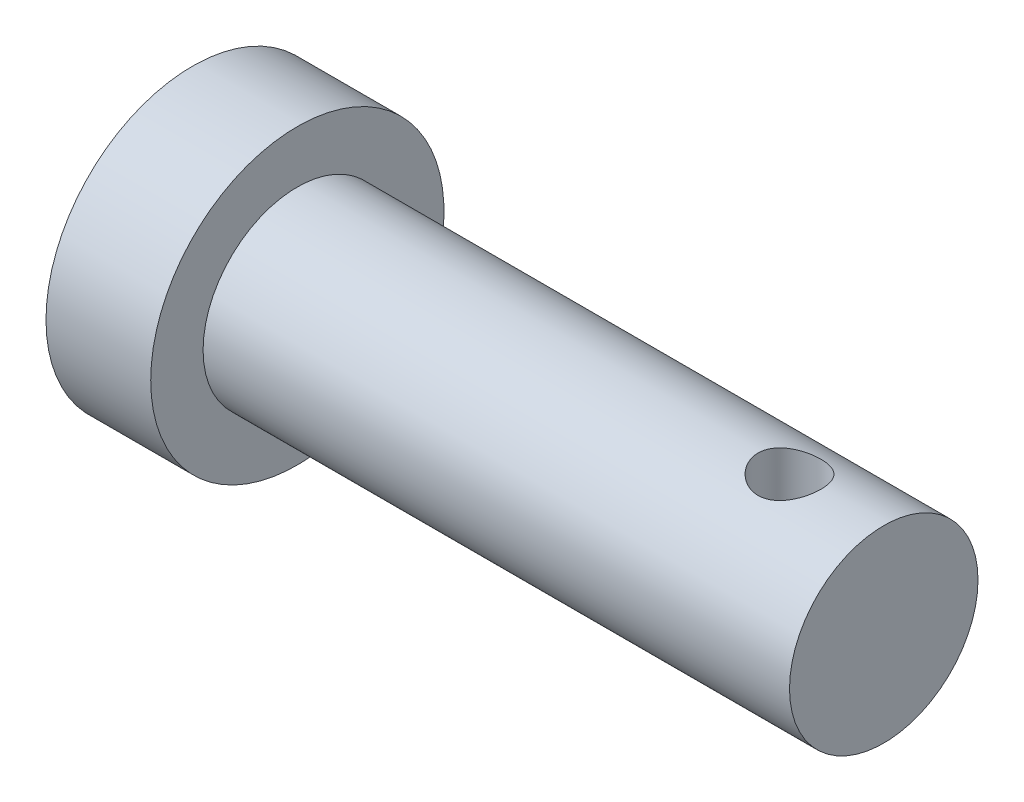
from build123d import *

# Parameters (mm, degrees)
SKETCH1_R               = 4.5
BOSS_EXTRUDE1_DEPTH     = 33
SKETCH2_R               = 7
BOSS_EXTRUDE2_DEPTH     = 5
CUT_EXTRUDE1_DEPTH      = 35.452866354
CUT_EXTRUDE1_DEPTH_BACK = 35.452866354
SKETCH3_R               = 1.5


with BuildPart() as part:
    # Sketch1 → Boss-Extrude1 (new body)
    with BuildSketch(Plane(origin=(0, 0, 0), x_dir=(0, 0, -1), z_dir=(1, 0, 0))):
        Circle(SKETCH1_R)
    extrude(amount=BOSS_EXTRUDE1_DEPTH)

    # Sketch2 → Boss-Extrude2 (add)
    with BuildSketch(Plane.ZY):
        Circle(SKETCH2_R)
    extrude(amount=-BOSS_EXTRUDE2_DEPTH)

    # Sketch3 → Cut-Extrude1 (cut, two sides: drawn at the far end of the back side and taken through both)
    with BuildSketch(Plane(origin=(0, 0, 0), x_dir=(1, 0, 0), z_dir=(0, 1, 0)).offset(-CUT_EXTRUDE1_DEPTH_BACK)):
        with Locations(Location((28.5, 0, 0), (0, 0, 270))):
            Circle(SKETCH3_R)
    extrude(amount=CUT_EXTRUDE1_DEPTH + CUT_EXTRUDE1_DEPTH_BACK, mode=Mode.SUBTRACT)


solid = part.part
